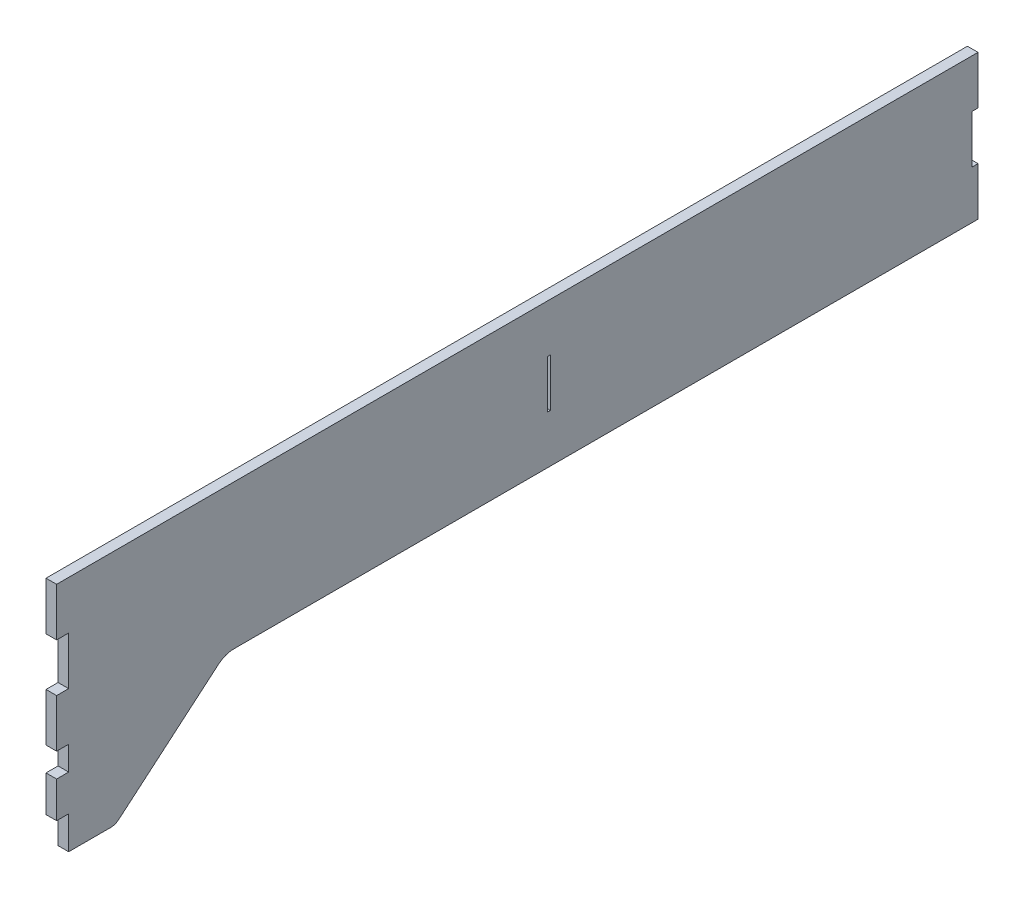
from build123d import *

# Parameters (mm, degrees)
SKETCH1_W           = 25.4
SKETCH1_H           = 1.5875
BOSS_EXTRUDE1_DEPTH = 5.588


with BuildPart() as part:
    # Sketch1 → Boss-Extrude1 (new body)
    # profile 1 of 2: a face of its own
    with BuildSketch(Plane(origin=(-94.488, 0, 0), x_dir=(0, -1, 0), z_dir=(-1, 0, 0))):
        Polygon((136.525, -196.85), (111.125, -196.85), (111.125, -203.2), (85.725, -203.2), (85.725, -196.85), (60.325, -196.85), (60.325, -682.625), (85.725, -682.625), (85.725, -679.45), (111.125, -679.45), (111.125, -682.625), (136.525, -682.625), align=None)
        with Locations((98.425, -456.40625)):
            Rectangle(SKETCH1_W, SKETCH1_H, mode=Mode.SUBTRACT)
    # profile 2 of 2: a face of its own
    with BuildSketch(Plane(origin=(-94.488, 0, 0), x_dir=(0, -1, 0), z_dir=(-1, 0, 0))):
        with BuildLine():
            Line((149.225, -203.2), (136.525, -203.2))
            Line((136.525, -203.2), (136.525, -290.406498707))
            ThreePointArc((136.525, -290.406498707), (137.30121982, -286.034603668), (139.534994681, -282.197126202))
            Line((139.534994681, -282.197126202), (184.118202659, -229.57294303))
            ThreePointArc((184.118202659, -229.57294303), (185.23509009, -227.654204297), (185.6232, -225.468256778))
            Line((185.6232, -225.468256778), (185.6232, -203.2))
            Line((185.6232, -203.2), (168.275, -203.2))
            Line((168.275, -203.2), (168.275, -196.85))
            Line((168.275, -196.85), (149.225, -196.85))
            Line((149.225, -196.85), (149.225, -203.2))
        make_face()
    extrude(amount=-BOSS_EXTRUDE1_DEPTH)


solid = part.part
